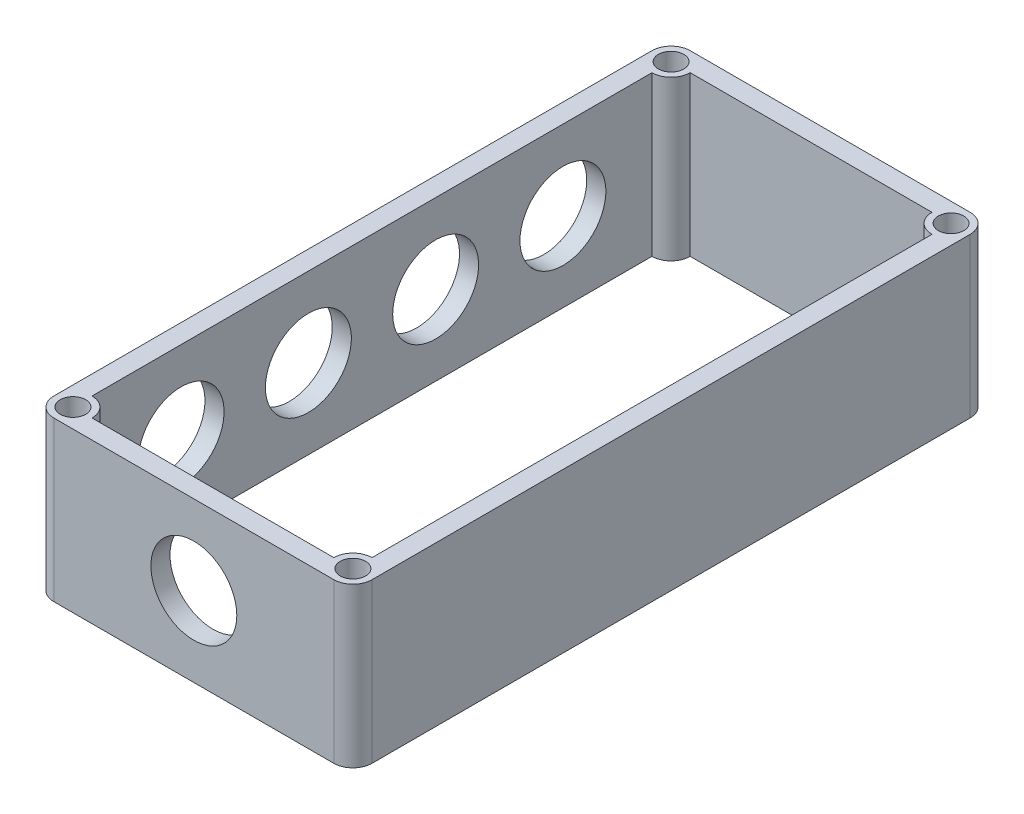
from build123d import *

# Parameters (mm, degrees)
SKETCH1_R           = 2
BOSS_EXTRUDE1_DEPTH = 25
CUT_EXTRUDE1_REACH  = 108.066
SKETCH2_R           = 6.75
CUT_EXTRUDE2_REACH  = 77
SKETCH3_R           = 6.75


with BuildPart() as part:
    # Sketch1 → Boss-Extrude1 (new body)
    with BuildSketch(Plane(origin=(0, 0, 0), x_dir=(1, 0, 0), z_dir=(0, 1, 0))):
        with BuildLine():
            ThreePointArc((-22, 50), (-24.121320344, 49.121320344), (-25, 47))
            Line((-25, 47), (-25, -47))
            ThreePointArc((-25, -47), (-24.121320344, -49.121320344), (-22, -50))
            Line((-22, -50), (22, -50))
            ThreePointArc((22, -50), (24.121320344, -49.121320344), (25, -47))
            Line((25, -47), (25, 47))
            ThreePointArc((25, 47), (24.121320344, 49.121320344), (22, 50))
            Line((22, 50), (-22, 50))
        make_face()
        with Locations(Location((-22, -47, 0), (0, 0, 270))):
            Circle(SKETCH1_R, mode=Mode.SUBTRACT)
        with BuildLine():
            Line((-22, -44), (-22, 44))
            ThreePointArc((-22, 44), (-19.878679656, 44.878679656), (-19, 47))
            Line((-19, 47), (19, 47))
            ThreePointArc((19, 47), (19.878679656, 44.878679656), (22, 44))
            Line((22, 44), (22, -44))
            ThreePointArc((22, -44), (19.878679656, -44.878679656), (19, -47))
            Line((19, -47), (-19, -47))
            ThreePointArc((-19, -47), (-19.878679656, -44.878679656), (-22, -44))
        make_face(mode=Mode.SUBTRACT)
        with Locations(Location((22, 47, 0), (0, 0, 270))):
            Circle(SKETCH1_R, mode=Mode.SUBTRACT)
        with Locations(Location((-22, 47, 0), (0, 0, 270))):
            Circle(SKETCH1_R, mode=Mode.SUBTRACT)
        with Locations(Location((22, -47, 0), (0, 0, 270))):
            Circle(SKETCH1_R, mode=Mode.SUBTRACT)
    extrude(amount=BOSS_EXTRUDE1_DEPTH)

    # Sketch2 → Cut-Extrude1 (cut, up to next)
    with BuildSketch(Plane.XY.offset(50), mode=Mode.PRIVATE) as cut_extrude1_sk1:
        with Locations((0, 12.5)):
            Circle(SKETCH2_R)
    cut_extrude1_tool1 = extrude(cut_extrude1_sk1.sketch, amount=-CUT_EXTRUDE1_REACH, mode=Mode.PRIVATE) & part.part
    add(cut_extrude1_tool1.solids().sort_by_distance((0, 12.5, 50))[0], mode=Mode.SUBTRACT)

    # Sketch3 → Cut-Extrude2 (cut, up to next)
    with BuildSketch(Plane.ZY.offset(25), mode=Mode.PRIVATE) as cut_extrude2_sk1:
        with Locations((-30, 12.5)):
            Circle(SKETCH3_R)
    cut_extrude2_tool1 = extrude(cut_extrude2_sk1.sketch, amount=-CUT_EXTRUDE2_REACH, mode=Mode.PRIVATE) & part.part
    # Sketch3 → Cut-Extrude2 (cut, up to next)
    with BuildSketch(Plane.ZY.offset(25), mode=Mode.PRIVATE) as cut_extrude2_sk2:
        with Locations((-10, 12.5)):
            Circle(SKETCH3_R)
    cut_extrude2_tool2 = extrude(cut_extrude2_sk2.sketch, amount=-CUT_EXTRUDE2_REACH, mode=Mode.PRIVATE) & part.part
    # Sketch3 → Cut-Extrude2 (cut, up to next)
    with BuildSketch(Plane.ZY.offset(25), mode=Mode.PRIVATE) as cut_extrude2_sk3:
        with Locations((10, 12.5)):
            Circle(SKETCH3_R)
    cut_extrude2_tool3 = extrude(cut_extrude2_sk3.sketch, amount=-CUT_EXTRUDE2_REACH, mode=Mode.PRIVATE) & part.part
    # Sketch3 → Cut-Extrude2 (cut, up to next)
    with BuildSketch(Plane.ZY.offset(25), mode=Mode.PRIVATE) as cut_extrude2_sk4:
        with Locations((30, 12.5)):
            Circle(SKETCH3_R)
    cut_extrude2_tool4 = extrude(cut_extrude2_sk4.sketch, amount=-CUT_EXTRUDE2_REACH, mode=Mode.PRIVATE) & part.part
    add(cut_extrude2_tool1.solids().sort_by_distance((-25, 12.5, -30))[0], mode=Mode.SUBTRACT)
    add(cut_extrude2_tool2.solids().sort_by_distance((-25, 12.5, -10))[0], mode=Mode.SUBTRACT)
    add(cut_extrude2_tool3.solids().sort_by_distance((-25, 12.5, 10))[0], mode=Mode.SUBTRACT)
    add(cut_extrude2_tool4.solids().sort_by_distance((-25, 12.5, 30))[0], mode=Mode.SUBTRACT)


solid = part.part
